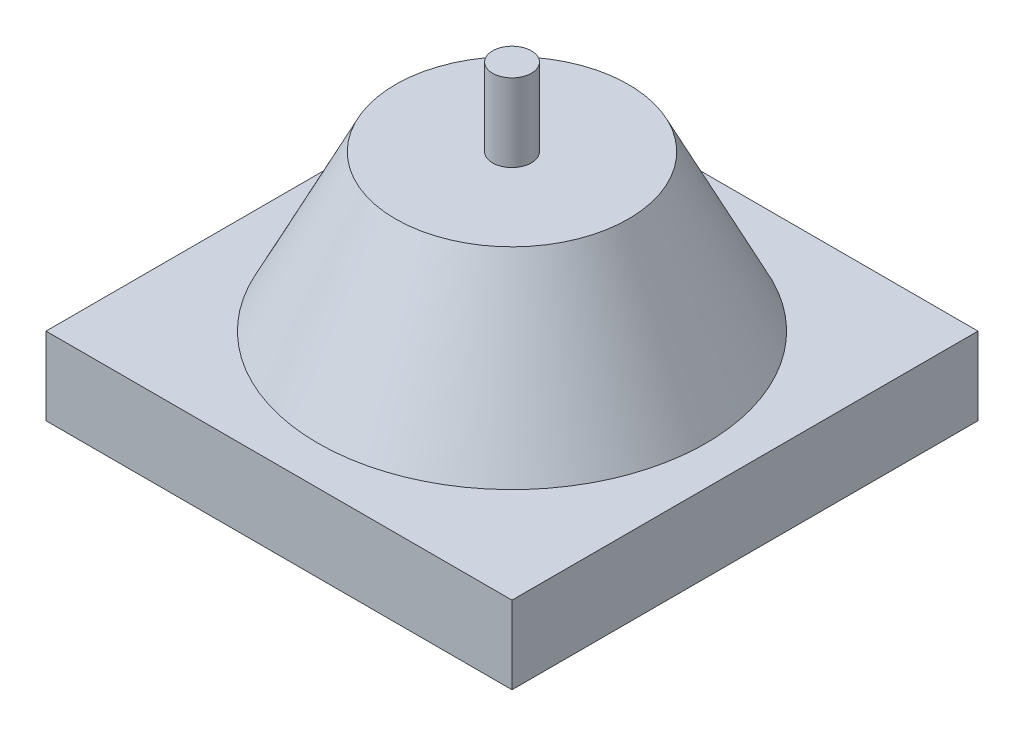
from build123d import *

# Parameters (mm, degrees)
SKETCH3_R           = 63.5
SKETCH5_R           = 38.1
SKETCH6_W           = 152.4
SKETCH6_H           = 152.4
BOSS_EXTRUDE1_DEPTH = 25.4
SKETCH7_R           = 6.35
BOSS_EXTRUDE2_DEPTH = 25.4


with BuildPart() as part:
    # Sketch3 → Loft1 section 0
    with BuildSketch(Plane(origin=(0, 0, 0), x_dir=(1, 0, 0), z_dir=(0, 1, 0))):
        Circle(SKETCH3_R)
    # Sketch5 → Loft1 section 1
    with BuildSketch(Plane(origin=(0, 50.8, 0), x_dir=(1, 0, 0), z_dir=(0, 1, 0))):
        Circle(SKETCH5_R)
    loft()

    # Sketch6 → Boss-Extrude1 (add)
    with BuildSketch(Plane.XZ):
        Rectangle(SKETCH6_W, SKETCH6_H)
    extrude(amount=BOSS_EXTRUDE1_DEPTH)

    # Sketch7 → Boss-Extrude2 (add)
    with BuildSketch(Plane(origin=(0, 50.8, 0), x_dir=(1, 0, 0), z_dir=(0, 1, 0))):
        with Locations(Location((0, 0, 0), (0, 0, 270))):
            Circle(SKETCH7_R)
    extrude(amount=BOSS_EXTRUDE2_DEPTH)


solid = part.part
